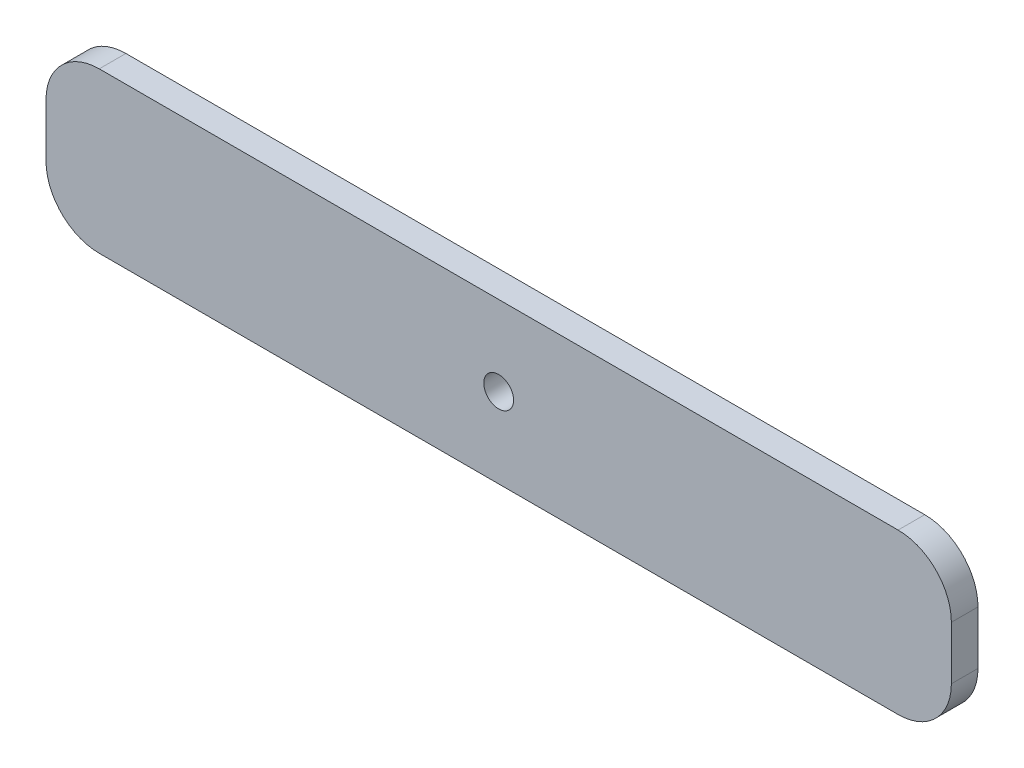
from build123d import *

# Parameters (mm, degrees)
ESQUISSE1_R        = 2.8
BOSS_EXTRU_1_DEPTH = 5


with BuildPart() as part:
    # Esquisse1 → Boss.-Extru.1 (new body)
    with BuildSketch(Plane.XY):
        with BuildLine():
            Line((10, 0), (160, 0))
            ThreePointArc((160, 0), (167.071067812, -2.928932188), (170, -10))
            Line((170, -10), (170, -20))
            ThreePointArc((170, -20), (167.071067812, -27.071067812), (160, -30))
            Line((160, -30), (10, -30))
            ThreePointArc((10, -30), (2.928932188, -27.071067812), (0, -20))
            Line((0, -20), (0, -10))
            ThreePointArc((0, -10), (2.928932188, -2.928932188), (10, 0))
        make_face()
        with Locations((85, -15)):
            Circle(ESQUISSE1_R, mode=Mode.SUBTRACT)
    extrude(amount=BOSS_EXTRU_1_DEPTH)


solid = part.part
